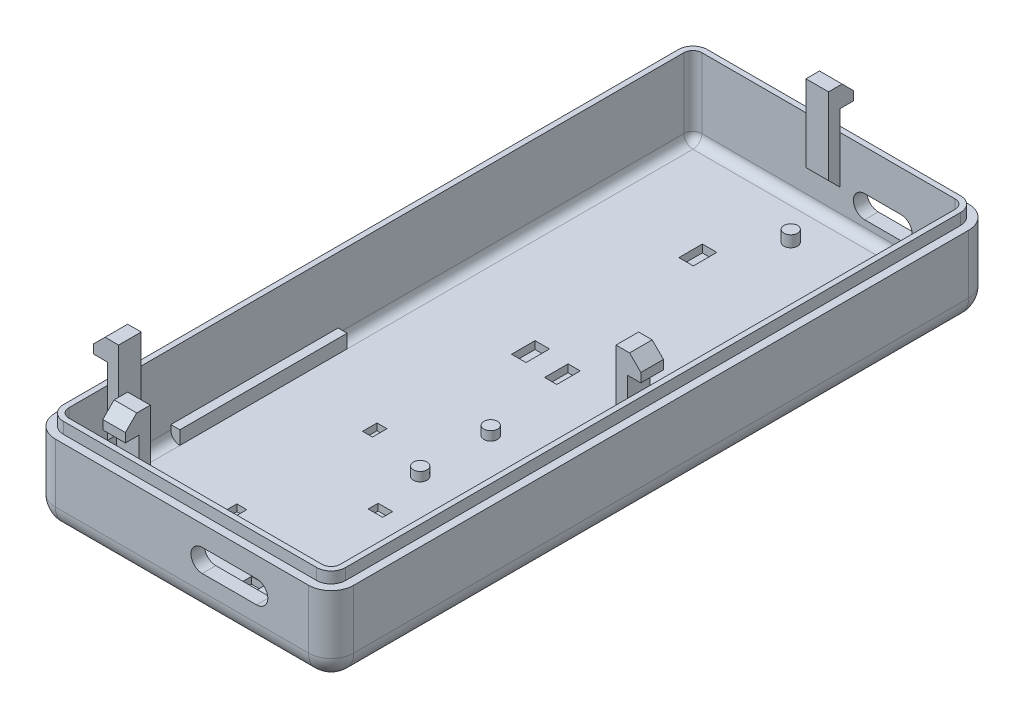
from build123d import *

# Parameters (mm, degrees)
ESBO_O2_W                  = 60
ESBO_O2_H                  = 140
RESSALTO_EXTRUS_O1_DEPTH   = 15
FILETE2_R                  = 2
CASCA3_T                   = 3
RESSALTO_EXTRUS_O2_START   = 2.5
RESSALTO_EXTRUS_O2_DEPTH   = 2.5
ESBO_O8_R                  = 2.5
RESSALTO_EXTRUS_O4_DEPTH   = 10.5
RESSALTO_EXTRUS_O4_2_DEPTH = 10.5
ESBO_O10_R                 = 2.5
ESBO_O10_R_2               = 1.25
CORTE_EXTRUS_O3_DEPTH      = 3
CORTE_EXTRUS_O2_DEPTH      = 3
CORTE_EXTRUS_O4_DEPTH      = 3
RESSALTO_EXTRUS_O6_DEPTH   = 10
INCLINA_O2_ANGLE           = 10
ESBO_O27_W                 = 1.99893937
ESBO_O27_H                 = 37
ESBO_O27_W_2               = 3.60569188
ESBO_O27_H_2               = 25.129374071
RESSALTO_EXTRUS_O17_DEPTH  = 3
ESBO_O28_W                 = 2.2
ESBO_O28_H                 = 3.2
ESBO_O28_W_2               = 3.2
ESBO_O28_H_2               = 2.2
CORTE_EXTRUS_O5_DEPTH      = 1.5
ESBO_O29_W                 = 3.2
ESBO_O29_H                 = 5.2
CORTE_EXTRUS_O6_DEPTH      = 1.7
ESBO_O30_R                 = 1.5
RESSALTO_EXTRUS_O18_DEPTH  = 2
ESBO_O31_R                 = 1.5
RESSALTO_EXTRUS_O19_DEPTH  = 2.5
ESBO_O32_W                 = 2.7
ESBO_O32_H                 = 5.2
CORTE_EXTRUS_O7_DEPTH      = 1.7
RESSALTO_EXTRUS_O20_DEPTH  = 2.5
RESSALTO_EXTRUS_O21_DEPTH  = 2.5
RESSALTO_EXTRUS_O22_DEPTH  = 2.5
RESSALTO_EXTRUS_O23_DEPTH  = 2.5


with BuildPart() as part:
    # Esboço2 → Ressalto-extrusão1 (new body)
    with BuildSketch(Plane(origin=(0, 0, 0), x_dir=(1, 0, 0), z_dir=(0, 1, 0))):
        Rectangle(ESBO_O2_W, ESBO_O2_H)
    extrude(amount=RESSALTO_EXTRUS_O1_DEPTH)

    # Filete2
    filete2_edges = [part.edges().sort_by_distance(p)[0] for p in [
        (0, 0, -70),
        (30, 0, 0),
        (0, 0, 70),
        (-30, 0, 0),
        (-30, 7.5, -70),
        (30, 7.5, -70),
        (30, 7.5, 70),
        (-30, 7.5, 70),
    ]]
    fillet(filete2_edges, radius=FILETE2_R)

    # Casca3
    casca3_openings = [part.faces().sort_by_distance(p)[0] for p in [
        (0, 15, 0),
    ]]
    offset(amount=CASCA3_T, openings=casca3_openings, kind=Kind.INTERSECTION)

    # Esboço3 → Ressalto-extrusão2 (add)
    with BuildSketch(Plane(origin=(0, 15, 0), x_dir=(1, 0, 0), z_dir=(0, 1, 0)).offset(RESSALTO_EXTRUS_O2_START)):
        with BuildLine():
            Line((31.2, -68), (31.2, 68))
            ThreePointArc((31.2, 68), (30.2627417, 70.2627417), (28, 71.2))
            Line((28, 71.2), (-28, 71.2))
            ThreePointArc((-28, 71.2), (-30.2627417, 70.2627417), (-31.2, 68))
            Line((-31.2, 68), (-31.2, -68))
            ThreePointArc((-31.2, -68), (-30.2627417, -70.2627417), (-28, -71.2))
            Line((-28, -71.2), (28, -71.2))
            ThreePointArc((28, -71.2), (30.2627417, -70.2627417), (31.2, -68))
        make_face()
        with BuildLine():
            Line((30, -68), (30, 68))
            ThreePointArc((30, 68), (29.414213562, 69.414213562), (28, 70))
            Line((28, 70), (-28, 70))
            ThreePointArc((-28, 70), (-29.414213562, 69.414213562), (-30, 68))
            Line((-30, 68), (-30, -68))
            ThreePointArc((-30, -68), (-29.414213562, -69.414213562), (-28, -70))
            Line((-28, -70), (28, -70))
            ThreePointArc((28, -70), (29.414213562, -69.414213562), (30, -68))
        make_face(mode=Mode.SUBTRACT)
    extrude(amount=-RESSALTO_EXTRUS_O2_DEPTH)

    # Esboço11 → Corte-extrusão2 (cut)
    with BuildSketch(Plane(origin=(0, 0, -73), x_dir=(-1, 0, 0), z_dir=(0, 0, -1))):
        with BuildLine():
            Line((-8, 3.5), (-16, 3.5))
            ThreePointArc((-16, 3.5), (-18.5, 6), (-16, 8.5))
            Line((-16, 8.5), (-8, 8.5))
            ThreePointArc((-8, 8.5), (-5.5, 6), (-8, 3.5))
        make_face()
    extrude(amount=-CORTE_EXTRUS_O2_DEPTH, mode=Mode.SUBTRACT)

    # Esboço15 → Corte-extrusão4 (cut)
    with BuildSketch(Plane.XY.offset(73)):
        with BuildLine():
            Line((16.5, 5.5), (4.5, 5.5))
            ThreePointArc((4.5, 5.5), (2, 8), (4.5, 10.5))
            Line((4.5, 10.5), (16.5, 10.5))
            ThreePointArc((16.5, 10.5), (19, 8), (16.5, 5.5))
        make_face()
    extrude(amount=-CORTE_EXTRUS_O4_DEPTH, mode=Mode.SUBTRACT)

    # Esboço12 → Ressalto-extrusão6 (add, symmetric)
    with BuildSketch(Plane(origin=(0, 0, 0), x_dir=(0, 0, -1), z_dir=(1, 0, 0))):
        Polygon((-10.5, -8), (0, -8), (10.5, -8), (15.5, -3), (19.742640687, -3), (11.742640687, -11), (0, -11), (-11.742640687, -11), (-19.742640687, -3), (-15.5, -3), align=None)
    extrude(amount=RESSALTO_EXTRUS_O6_DEPTH, both=True)

    # Inclinação2
    inclina_o2_faces = [part.faces().sort_by_distance(p)[0] for p in [
        (-10, -8.070705529, 0),
        (10, -8.070705529, 0),
    ]]
    draft(inclina_o2_faces, Plane(origin=(10, -11, -11.742640687), x_dir=(0, 0, -1), z_dir=(0, -1, 0)), INCLINA_O2_ANGLE)

    # Esboço27 → Ressalto-extrusão17 (add)
    with BuildSketch(Plane(origin=(0, 0, 0), x_dir=(1, 0, 0), z_dir=(0, 1, 0))):
        with Locations((-29.000530315, -26.956652641)):
            Rectangle(ESBO_O27_W, ESBO_O27_H)
        with Locations((28.19715406, -49.700857668)):
            Rectangle(ESBO_O27_W_2, ESBO_O27_H_2)
    extrude(amount=RESSALTO_EXTRUS_O17_DEPTH)

    # Esboço28 → Corte-extrusão5 (cut)
    with BuildSketch(Plane(origin=(0, 0, 0), x_dir=(1, 0, 0), z_dir=(0, 1, 0))):
        with Locations((-9.40569188, -20.950857667)):
            Rectangle(ESBO_O28_W, ESBO_O28_H)
        with Locations((-9.40569188, -51.950857667)):
            Rectangle(ESBO_O28_W, ESBO_O28_H)
        with Locations((6.59430812, -63.700857667)):
            Rectangle(ESBO_O28_W_2, ESBO_O28_H_2)
        with Locations((6.59430812, -35.700857667)):
            Rectangle(ESBO_O28_W_2, ESBO_O28_H_2)
    extrude(amount=-CORTE_EXTRUS_O5_DEPTH, mode=Mode.SUBTRACT)

    # Esboço29 → Corte-extrusão6 (cut)
    with BuildSketch(Plane(origin=(0, 0, 0), x_dir=(1, 0, 0), z_dir=(0, 1, 0))):
        with Locations((-7.2, 11.3)):
            Rectangle(ESBO_O29_W, ESBO_O29_H)
        with Locations((-7.2, 48.3)):
            Rectangle(ESBO_O29_W, ESBO_O29_H)
    extrude(amount=-CORTE_EXTRUS_O6_DEPTH, mode=Mode.SUBTRACT)

    # Esboço30 → Ressalto-extrusão18 (add)
    with BuildSketch(Plane(origin=(0, 0, 0), x_dir=(1, 0, 0), z_dir=(0, 1, 0))):
        with Locations(Location((4.5, -24.8, 0), (0, 0, 270))):
            Circle(ESBO_O30_R)
        with Locations(Location((4.5, -9.2, 0), (0, 0, 90))):
            Circle(ESBO_O30_R)
        with Locations(Location((21.5, -9.2, 0), (0, 0, 270))):
            Circle(ESBO_O30_R)
        with Locations(Location((21.5, -24.8, 0), (0, 0, 90))):
            Circle(ESBO_O30_R)
    extrude(amount=RESSALTO_EXTRUS_O18_DEPTH)

    # Esboço31 → Ressalto-extrusão19 (add)
    with BuildSketch(Plane(origin=(0, 0, 0), x_dir=(1, 0, 0), z_dir=(0, 1, 0))):
        with Locations(Location((0.65, 61, 0), (0, 0, 270))):
            Circle(ESBO_O31_R)
        with Locations(Location((23.35, 61, 0), (0, 0, 270))):
            Circle(ESBO_O31_R)
    extrude(amount=RESSALTO_EXTRUS_O19_DEPTH)

    # Esboço32 → Corte-extrusão7 (cut)
    with BuildSketch(Plane(origin=(0, 0, 0), x_dir=(1, 0, 0), z_dir=(0, 1, 0))):
        with Locations((0.65, 10.5)):
            Rectangle(ESBO_O32_W, ESBO_O32_H)
        with Locations((23.35, 10.5)):
            Rectangle(ESBO_O32_W, ESBO_O32_H)
    extrude(amount=-CORTE_EXTRUS_O7_DEPTH, mode=Mode.SUBTRACT)

    # Esboço34 → Ressalto-extrusão20 (add, symmetric)
    with BuildSketch(Plane(origin=(0, 0, 57), x_dir=(-1, 0, 0), z_dir=(0, 0, -1))):
        Polygon((30, 7), (30, 22), (33, 22), (33, 24), (30.5, 26.5), (27.5, 26.5), (27.5, 9.5), align=None)
    extrude(amount=RESSALTO_EXTRUS_O20_DEPTH, both=True)

    # Esboço35 → Ressalto-extrusão21 (add, symmetric)
    with BuildSketch(Plane.ZY.offset(15)):
        Polygon((70, 7), (70, 22), (73, 22), (73, 24), (70.5, 26.5), (67.5, 26.5), (67.5, 9.5), align=None)
    extrude(amount=RESSALTO_EXTRUS_O21_DEPTH, both=True)

    # Esboço36 → Ressalto-extrusão22 (add, symmetric)
    with BuildSketch(Plane.XY.offset(2)):
        Polygon((30, 7), (30, 22), (33, 22), (33, 24), (30.5, 26.5), (27.5, 26.5), (27.5, 9.5), align=None)
    extrude(amount=RESSALTO_EXTRUS_O22_DEPTH, both=True)

    # Esboço37 → Ressalto-extrusão23 (add, symmetric)
    with BuildSketch(Plane(origin=(0, 0, 0), x_dir=(0, 0, -1), z_dir=(1, 0, 0))):
        Polygon((70, 7), (70, 22), (73, 22), (73, 24), (70.5, 26.5), (67.5, 26.5), (67.5, 9.5), align=None)
    extrude(amount=RESSALTO_EXTRUS_O23_DEPTH, both=True)


with BuildPart() as body_2:
    # Esboço8 → Ressalto-extrusão4 (new body)
    with BuildSketch(Plane(origin=(0, 0, 0), x_dir=(1, 0, 0), z_dir=(0, 1, 0))):
        with Locations(Location((24.35, 61, 0), (0, 0, 90))):
            Circle(ESBO_O8_R)
    extrude(amount=RESSALTO_EXTRUS_O4_DEPTH)


with BuildPart() as body_3:
    # Esboço8 → Ressalto-extrus_o4 2 (new body)
    with BuildSketch(Plane(origin=(0, 0, 0), x_dir=(1, 0, 0), z_dir=(0, 1, 0))):
        with BuildLine():
            Line((23.1, 13), (23.1, 10.5))
            Line((23.1, 10.5), (25.6, 10.5))
            Line((25.6, 10.5), (25.6, 13))
            ThreePointArc((25.6, 13), (24.35, 14.25), (23.1, 13))
        make_face()
    extrude(amount=RESSALTO_EXTRUS_O4_2_DEPTH)


with BuildPart() as corte_extrus_o3_tool:
    # Esboço10 → Corte-extrusão3 (new body)
    # profile 1 of 2: a face of its own
    with BuildSketch(Plane(origin=(0, 10.5, 0), x_dir=(1, 0, 0), z_dir=(0, 1, 0))):
        with Locations(Location((24.35, 61, 0), (0, 0, 90))):
            Circle(ESBO_O10_R)
        with Locations(Location((24.35, 61, 0), (0, 0, 270))):
            Circle(ESBO_O10_R_2, mode=Mode.SUBTRACT)
    # profile 2 of 2: a face of its own
    with BuildSketch(Plane(origin=(0, 10.5, 0), x_dir=(1, 0, 0), z_dir=(0, 1, 0))):
        with BuildLine():
            Line((25.6, 10.5), (25.6, 13))
            ThreePointArc((25.6, 13), (24.35, 11.75), (23.1, 13))
            Line((23.1, 13), (23.1, 10.5))
            Line((23.1, 10.5), (25.6, 10.5))
        make_face()
    extrude(amount=-CORTE_EXTRUS_O3_DEPTH)


with BuildPart() as body_2_1:
    add(body_2.part)

    # Corte-extrusão3: cut by corte_extrus_o3_tool
    add(corte_extrus_o3_tool.part, mode=Mode.SUBTRACT)


with BuildPart() as body_3_1:
    add(body_3.part)

    # Corte-extrusão3: cut by corte_extrus_o3_tool
    add(corte_extrus_o3_tool.part, mode=Mode.SUBTRACT)


solid = Compound([part.part, body_2_1.part, body_3_1.part])
